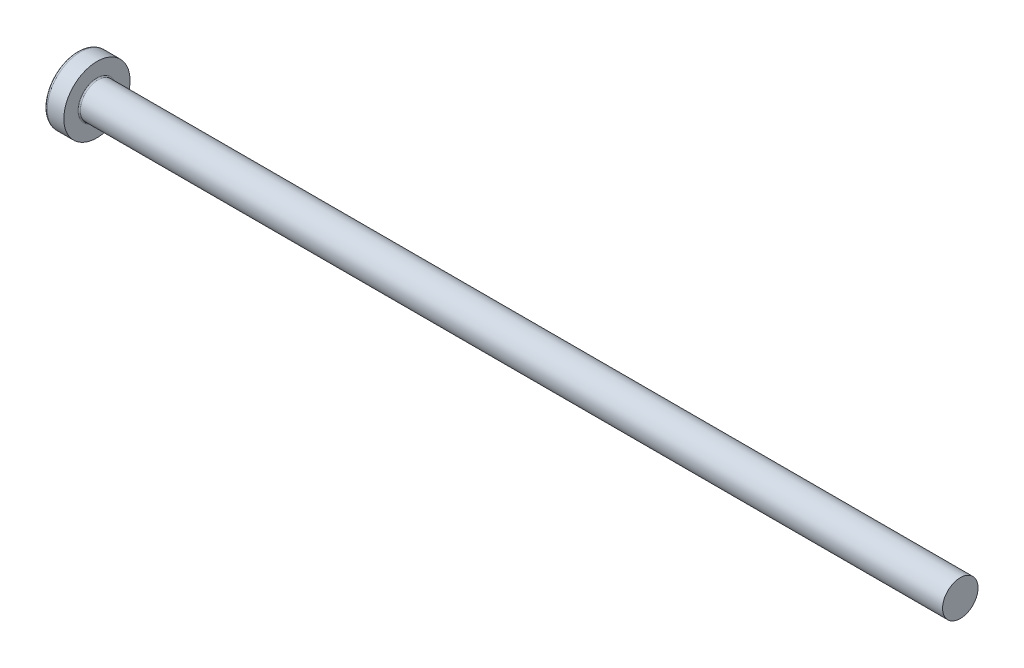
from build123d import *

# Parameters (mm, degrees)
FILLET1_R    = 0.1
RECPAT_COUNT = 2
RECPAT_ANGLE = 90


with BuildPart() as part:
    # BodySke → Base-Revolve (revolve)
    with BuildSketch(Plane.XY, mode=Mode.PRIVATE) as base_revolve_sk:
        with BuildLine():
            Line((2.4, 1.5), (2.4, 2.8))
            Line((2.4, 2.8), (1.003501533, 2.8))
            ThreePointArc((1.003501533, 2.8), (0.873295971, 2.76653015), (0.775371599, 2.674418605))
            ThreePointArc((0.775371599, 2.674418605), (0.197753546, 1.392274756), (0, 0))
            Line((0, 0), (75.4, 0))
            Line((75.4, 0), (75.4, 1.5))
            Line((75.4, 1.5), (2.4, 1.5))
        make_face()
    revolve(base_revolve_sk.sketch.rotate(Axis((1.003501533, 0, 0), (1, 0, 0)), 90), axis=Axis((1.003501533, 0, 0), (1, 0, 0)))

    # Fillet1
    fillet1_edges = [part.edges().sort_by_distance(p)[0] for p in [
        (2.4, 0, -1.5),
    ]]
    fillet(fillet1_edges, radius=FILLET1_R)

    # Sketch3 → Recess section 0
    with BuildSketch(Plane(origin=(0, 0, 0), x_dir=(0, 0, -1), z_dir=(1, 0, 0))):
        with BuildLine():
            Line((0.37, -1.4), (-0.37, -1.4))
            Line((-0.37, -1.4), (-0.37, 1.4))
            Line((-0.37, 1.4), (0.37, 1.4))
            Line((0.37, 1.4), (0.37, -1.4))
        make_face()
    # Sketch4 → Recess section 1
    with BuildSketch(Plane(origin=(1.75, 0, 0), x_dir=(0, 0, -1), z_dir=(1, 0, 0))):
        with BuildLine():
            Line((0.37, -0.527482332), (-0.37, -0.527482332))
            Line((-0.37, -0.527482332), (-0.37, 0.527482332))
            Line((-0.37, 0.527482332), (0.37, 0.527482332))
            Line((0.37, 0.527482332), (0.37, -0.527482332))
        make_face()
    recess = loft(mode=Mode.SUBTRACT)

    # RecPat: Recess ×2 about axis
    recpat_axis = Axis((0, 0, 0), (1, 0, 0))
    for i in range(1, RECPAT_COUNT):
        add(recess.rotate(recpat_axis, i * RECPAT_ANGLE / (RECPAT_COUNT - 1)), mode=Mode.SUBTRACT)

    # RecCorSke → RecessCore (revolve, cut)
    with BuildSketch(Plane.XY, mode=Mode.PRIVATE) as recesscore_sk:
        Polygon((0, 0), (0, 0.678371921), (1.75, 0.556), (1.930655351, 0), align=None)
    revolve(recesscore_sk.sketch.rotate(Axis((-3.175, 0, 0), (1, 0, 0)), 15.814025638), axis=Axis((-3.175, 0, 0), (1, 0, 0)), mode=Mode.SUBTRACT)


solid = part.part
